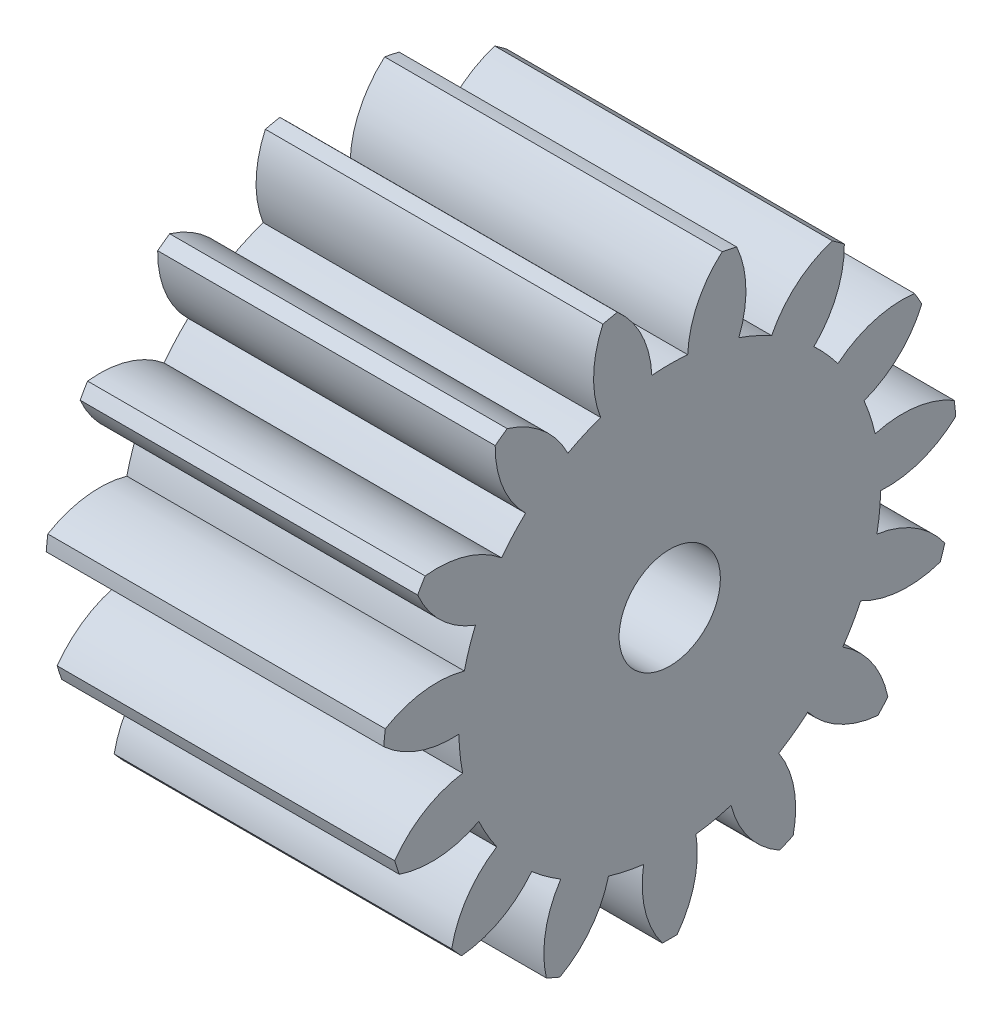
from build123d import *

# Parameters (mm, degrees)
BASPROSKE_W        = 10
BASPROSKE_H        = 8.5
TOOTHCUT_DEPTH     = 16.636495771
TEETHCUTS_COUNT    = 15
TEETHCUTS_ANGLE    = 336
BORSKE_R           = 0.4
BORE_DEPTH         = 50.0000508
CUT_EXTRUDE1_REACH = 17.622
SKETCH1_R          = 1.5


with BuildPart() as part:
    # BasProSke → Base-Revolve (revolve)
    with BuildSketch(Plane(origin=(0, 0, 0), x_dir=(1, 0, 0), z_dir=(0, 1, 0)), mode=Mode.PRIVATE) as base_revolve_sk:
        with Locations((5, 4.25)):
            Rectangle(BASPROSKE_W, BASPROSKE_H)
    revolve(base_revolve_sk.sketch.rotate(Axis((-10, 0, 0), (1, 0, 0)), 180), axis=Axis((-10, 0, 0), (1, 0, 0)))

    # TooCutSke → ToothCut (cut, through all)
    with BuildSketch(Plane(origin=(0, 0, 0), x_dir=(0, 0, -1), z_dir=(1, 0, 0))):
        with BuildLine():
            ThreePointArc((0.531576138, 6.226349477), (0, 6.249), (-0.531576138, 6.226349477))
            ThreePointArc((-0.531576138, 6.226349477), (-0.830301624, 7.411024729), (-1.576608494, 8.378350125))
            ThreePointArc((-1.576608494, 8.378350125), (0, 8.5254), (1.576608494, 8.378350125))
            ThreePointArc((1.576608494, 8.378350125), (0.830301624, 7.411024729), (0.531576138, 6.226349477))
        make_face()
    toothcut = extrude(amount=TOOTHCUT_DEPTH, mode=Mode.SUBTRACT)

    # TeethCuts: ToothCut ×15 about axis
    teethcuts_axis = Axis((-10, 0, 0), (1, 0, 0))
    for i in range(1, TEETHCUTS_COUNT):
        add(toothcut.rotate(teethcuts_axis, i * TEETHCUTS_ANGLE / (TEETHCUTS_COUNT - 1)), mode=Mode.SUBTRACT)

    # BorSke → Bore (cut, symmetric)
    with BuildSketch(Plane(origin=(0, 0, 0), x_dir=(0, 0, -1), z_dir=(1, 0, 0))):
        with Locations(Location((0, 0, 0), (0, 0, 180))):
            Circle(BORSKE_R)
    extrude(amount=BORE_DEPTH, both=True, mode=Mode.SUBTRACT)

    # Sketch1 → Cut-Extrude1 (cut, up to next)
    with BuildSketch(Plane(origin=(10, 0, 0), x_dir=(0, 0, -1), z_dir=(1, 0, 0)), mode=Mode.PRIVATE) as cut_extrude1_sk1:
        Circle(SKETCH1_R)
    cut_extrude1_tool1 = extrude(cut_extrude1_sk1.sketch, amount=-CUT_EXTRUDE1_REACH, mode=Mode.PRIVATE) & part.part
    add(cut_extrude1_tool1.solids().sort_by_distance((10, 0, 0))[0], mode=Mode.SUBTRACT)


solid = part.part
